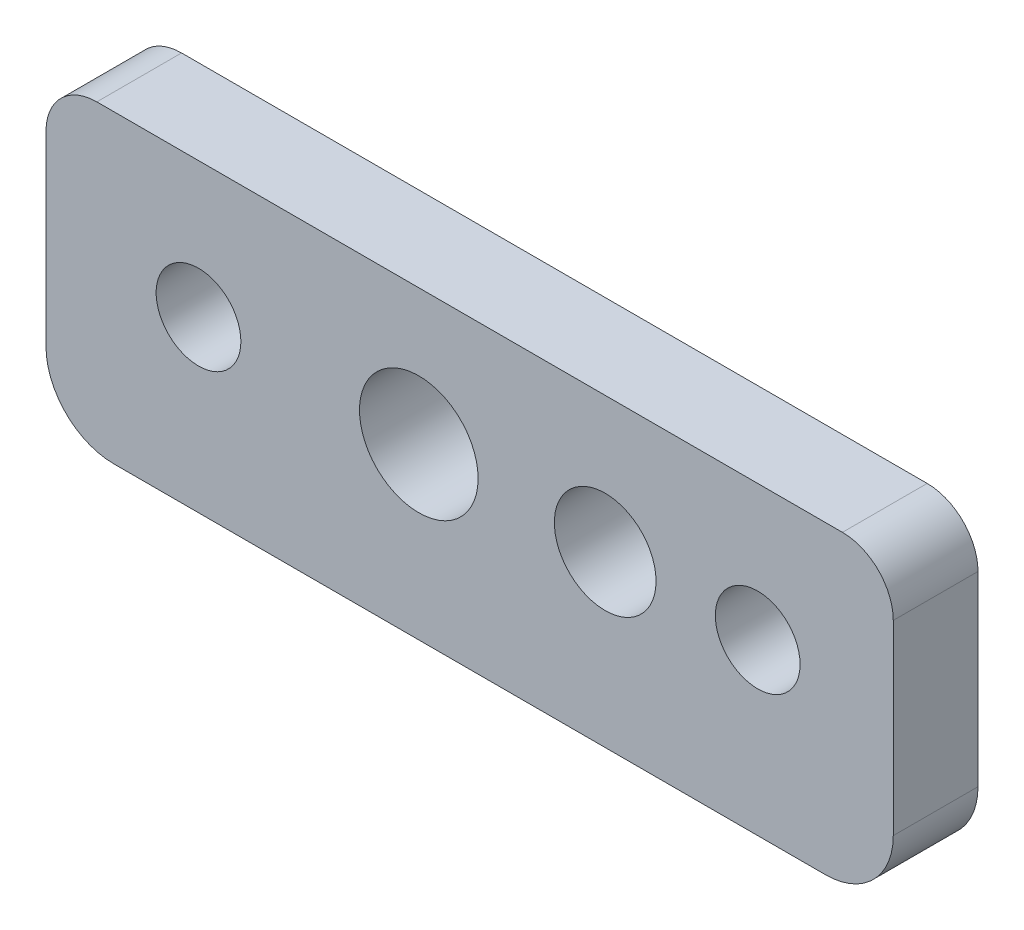
from build123d import *

# Parameters (mm, degrees)
CROQUIS1_W              = 250
CROQUIS1_H              = 90
CROQUIS1_R              = 12.5
CROQUIS1_R_2            = 17.5
CROQUIS1_R_3            = 15
SALIENTE_EXTRUIR1_DEPTH = 25
REDONDEO1_R             = 15
REDONDEO2_R             = 20


with BuildPart() as part:
    # Croquis1 → Saliente-Extruir1 (new body)
    with BuildSketch(Plane.XY):
        with Locations((125, -45)):
            Rectangle(CROQUIS1_W, CROQUIS1_H)
        with Locations((45, -40)):
            Circle(CROQUIS1_R, mode=Mode.SUBTRACT)
        with Locations((110, -40)):
            Circle(CROQUIS1_R_2, mode=Mode.SUBTRACT)
        with Locations((165, -40)):
            Circle(CROQUIS1_R_3, mode=Mode.SUBTRACT)
        with Locations((210, -40)):
            Circle(CROQUIS1_R, mode=Mode.SUBTRACT)
    extrude(amount=SALIENTE_EXTRUIR1_DEPTH)

    # Redondeo1
    redondeo1_edges = [part.edges().sort_by_distance(p)[0] for p in [
        (0, 0, 12.5),
        (250, 0, 12.5),
    ]]
    fillet(redondeo1_edges, radius=REDONDEO1_R)

    # Redondeo2
    redondeo2_edges = [part.edges().sort_by_distance(p)[0] for p in [
        (250, -90, 12.5),
        (0, -90, 12.5),
    ]]
    fillet(redondeo2_edges, radius=REDONDEO2_R)


solid = part.part
